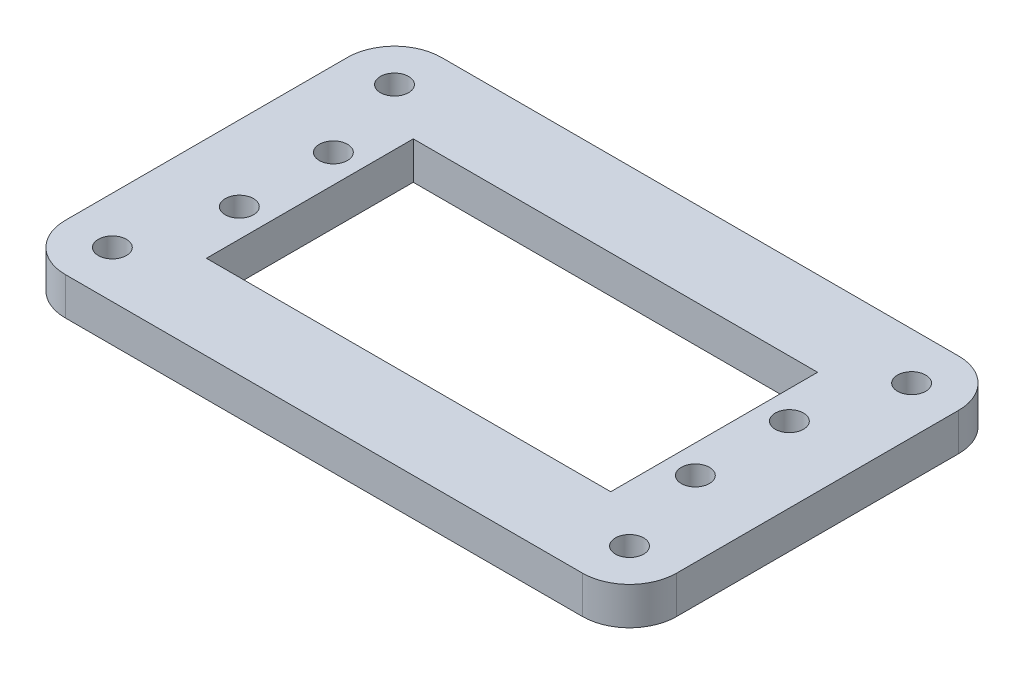
from build123d import *

# Parameters (mm, degrees)
SKETCH1_W           = 65
SKETCH1_H           = 40
SKETCH1_W_2         = 43
SKETCH1_H_2         = 22
BOSS_EXTRUDE1_DEPTH = 4
SKETCH2_R           = 1.5
CUT_EXTRUDE1_DEPTH  = 39.369910086
FILLET1_R           = 5
FILLET2_R           = 5
FILLET3_R           = 5
FILLET4_R           = 5


with BuildPart() as part:
    # Sketch1 → Boss-Extrude1 (new body)
    with BuildSketch(Plane(origin=(0, 0, 0), x_dir=(1, 0, 0), z_dir=(0, 1, 0))):
        Rectangle(SKETCH1_W, SKETCH1_H)
        Rectangle(SKETCH1_W_2, SKETCH1_H_2, mode=Mode.SUBTRACT)
    extrude(amount=BOSS_EXTRUDE1_DEPTH)

    # Sketch2 → Cut-Extrude1 (cut, through all)
    with BuildSketch(Plane(origin=(0, 4, 0), x_dir=(1, 0, 0), z_dir=(0, 1, 0))):
        with Locations(Location((-24.5, 5.504503052, 0), (0, 0, 270))):
            Circle(SKETCH2_R)
        with Locations(Location((-24.5, -4.495496948, 0), (0, 0, 270))):
            Circle(SKETCH2_R)
        with Locations(Location((24.5, 5, 0), (0, 0, 270))):
            Circle(SKETCH2_R)
        with Locations(Location((24.5, -5, 0), (0, 0, 270))):
            Circle(SKETCH2_R)
        with Locations(Location((-27.5, 15, 0), (0, 0, 270))):
            Circle(SKETCH2_R)
        with Locations(Location((27.5, 15, 0), (0, 0, 270))):
            Circle(SKETCH2_R)
        with Locations(Location((27.5, -15, 0), (0, 0, 270))):
            Circle(SKETCH2_R)
        with Locations(Location((-27.5, -15, 0), (0, 0, 270))):
            Circle(SKETCH2_R)
    extrude(amount=-CUT_EXTRUDE1_DEPTH, mode=Mode.SUBTRACT)

    # Fillet1
    fillet1_edges = [part.edges().sort_by_distance(p)[0] for p in [
        (-32.5, 2, -20),
    ]]
    fillet(fillet1_edges, radius=FILLET1_R)

    # Fillet2
    fillet2_edges = [part.edges().sort_by_distance(p)[0] for p in [
        (32.5, 2, -20),
    ]]
    fillet(fillet2_edges, radius=FILLET2_R)

    # Fillet3
    fillet3_edges = [part.edges().sort_by_distance(p)[0] for p in [
        (32.5, 2, 20),
    ]]
    fillet(fillet3_edges, radius=FILLET3_R)

    # Fillet4
    fillet4_edges = [part.edges().sort_by_distance(p)[0] for p in [
        (-32.5, 2, 20),
    ]]
    fillet(fillet4_edges, radius=FILLET4_R)


solid = part.part
